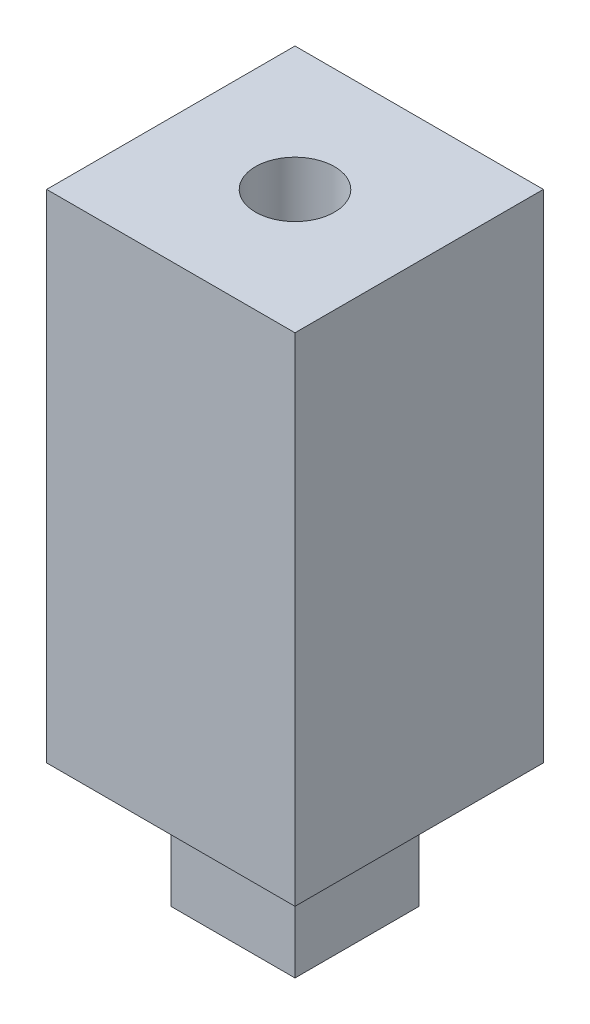
from build123d import *

# Parameters (mm, degrees)
SKETCH1_W                  = 12.7
SKETCH1_H                  = 12.7
BOSS_EXTRUDE1_DEPTH        = 25.4
SKETCH2_W                  = 6.35
SKETCH2_H                  = 6.35
BOSS_EXTRUDE2_DEPTH        = 6.35
F_10_32_TAPPED_HOLE2_D     = 4.0386
F_10_32_TAPPED_HOLE2_DEPTH = 12.7
F_10_32_TAPPED_HOLE2_TIP   = 1.213317848
F_10_32_TAPPED_HOLE3_D     = 4.0386
F_10_32_TAPPED_HOLE3_DEPTH = 12.7
F_10_32_TAPPED_HOLE3_TIP   = 1.213317848


with BuildPart() as part:
    # Sketch1 → Boss-Extrude1 (new body)
    with BuildSketch(Plane(origin=(0, 0, 0), x_dir=(1, 0, 0), z_dir=(0, 1, 0))):
        Rectangle(SKETCH1_W, SKETCH1_H)
    extrude(amount=BOSS_EXTRUDE1_DEPTH)

    # Sketch2 → Boss-Extrude2 (add)
    with BuildSketch(Plane.XZ):
        Rectangle(SKETCH2_W, SKETCH2_H)
    extrude(amount=BOSS_EXTRUDE2_DEPTH)

    # #10-32 Tapped Hole2
    with Locations(Plane(origin=(0, -6.35, 0), x_dir=(-1, 0, 0), z_dir=(0, -1, 0))):
        with Locations((0, 0)):
            Hole(F_10_32_TAPPED_HOLE2_D / 2, depth=F_10_32_TAPPED_HOLE2_DEPTH)
            with Locations((0, 0, -(F_10_32_TAPPED_HOLE2_DEPTH + F_10_32_TAPPED_HOLE2_TIP / 2))):  # 118° drill point
                Cone(0, F_10_32_TAPPED_HOLE2_D / 2, F_10_32_TAPPED_HOLE2_TIP, mode=Mode.SUBTRACT)

    # #10-32 Tapped Hole3
    with Locations(Plane(origin=(0, 25.4, 0), x_dir=(1, 0, 0), z_dir=(0, 1, 0))):
        with Locations((0, 0)):
            Hole(F_10_32_TAPPED_HOLE3_D / 2, depth=F_10_32_TAPPED_HOLE3_DEPTH)
            with Locations((0, 0, -(F_10_32_TAPPED_HOLE3_DEPTH + F_10_32_TAPPED_HOLE3_TIP / 2))):  # 118° drill point
                Cone(0, F_10_32_TAPPED_HOLE3_D / 2, F_10_32_TAPPED_HOLE3_TIP, mode=Mode.SUBTRACT)


solid = part.part
